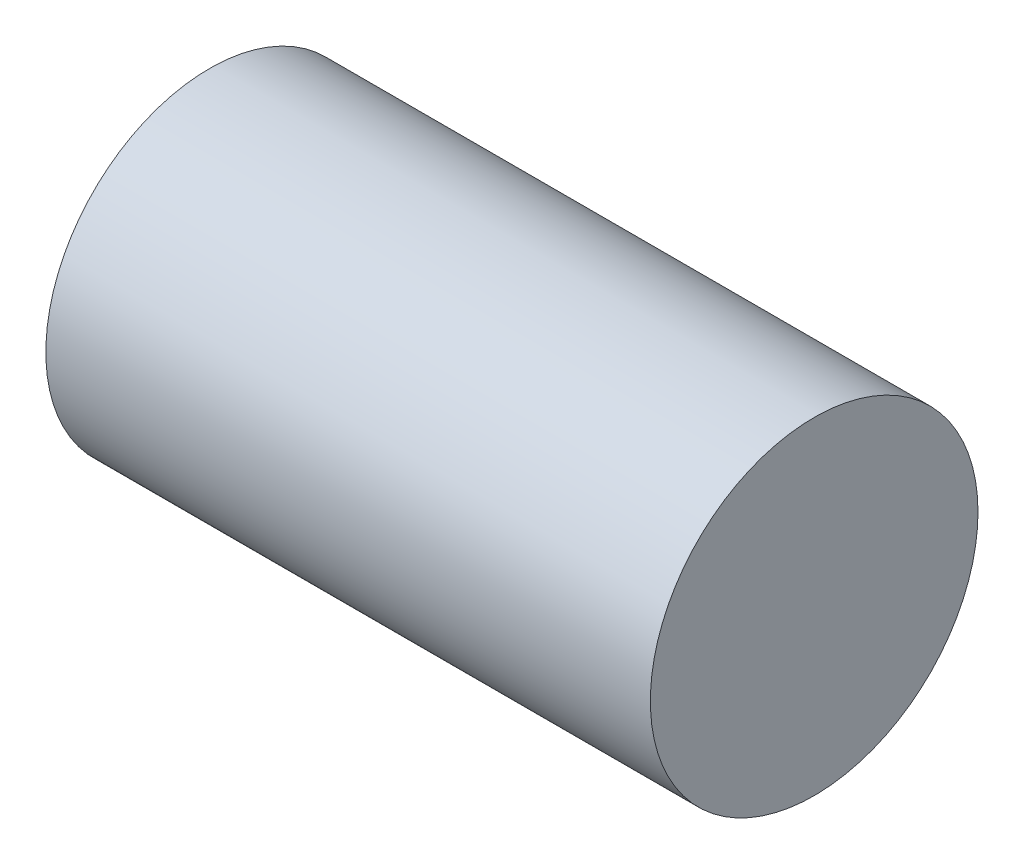
from build123d import *

# Parameters (mm, degrees)
SKETCH1_R           = 3.97
BOSS_EXTRUDE1_DEPTH = 14.65


with BuildPart() as part:
    # Sketch1 → Boss-Extrude1 (new body)
    with BuildSketch(Plane.YZ):
        with Locations(Location((0, 0, 0), (0, 0, 270))):
            Circle(SKETCH1_R)
    extrude(amount=BOSS_EXTRUDE1_DEPTH)


solid = part.part
